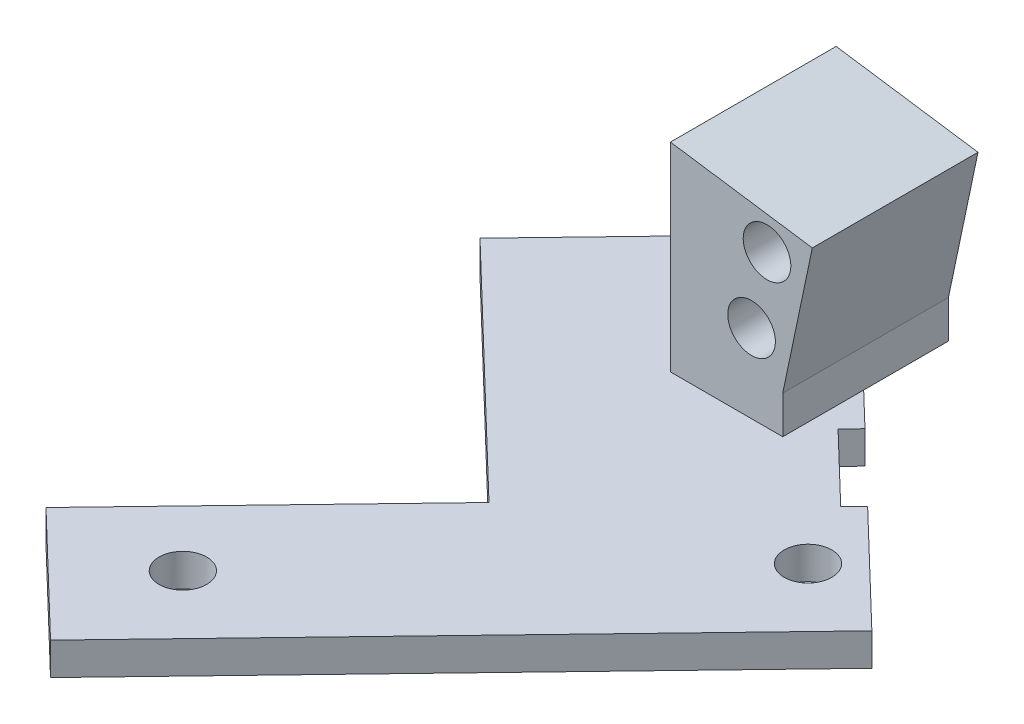
from build123d import *

# Parameters (mm, degrees)
SKETCH1_R            = 3.175
BOSS_EXTRUDE1_DEPTH  = 22.098
SKETCH2_W            = 6.364573253
SKETCH2_H            = 22.098
BOSS_EXTRUDE2_DEPTH  = 8.89
SKETCH12_R           = 3.175
BOSS_EXTRUDE6_DEPTH  = 4.326760245
BOSS_EXTRUDE12_DEPTH = 22.098
CUT_EXTRUDE1_DEPTH   = 35.052
BOSS_EXTRUDE13_DEPTH = 22.098
BOSS_EXTRUDE14_REACH = 685.189
SKETCH22_W           = 11.177544577
SKETCH22_H           = 22.098
CUT_EXTRUDE3_DEPTH   = 39.878
CUT_EXTRUDE4_DEPTH   = 684.154025117


with BuildPart() as part:
    # Sketch1 → Boss-Extrude1 (new body)
    with BuildSketch(Plane.XY):
        Polygon((-629.011320926, 228.514758378), (-646.417262265, 232.174381811), (-650.357758597, 213.432549691), (-632.951817258, 209.772926258), align=None)
        with Locations(Location((-635.053635704, 225, 0), (0, 0, 180))):
            Circle(SKETCH1_R, mode=Mode.SUBTRACT)
        with Locations(Location((-637.11116423, 215.213960129, 0), (0, 0, 180))):
            Circle(SKETCH1_R, mode=Mode.SUBTRACT)
    extrude(amount=BOSS_EXTRUDE1_DEPTH)

    # Sketch2 → Boss-Extrude2 (add)
    with BuildSketch(Plane(origin=(15.442364745, 73.44714554, 0), x_dir=(0.9786039871389689, -0.20575285260650125, 0), z_dir=(-0.20575285260650128, -0.978603987138969, 0))):
        with Locations((-677.174764942, 11.049)):
            Rectangle(SKETCH2_W, SKETCH2_H)
    extrude(amount=BOSS_EXTRUDE2_DEPTH)

    # Sketch12 → Boss-Extrude6 (add)
    with BuildSketch(Plane(origin=(0, 204.732760245, 0), x_dir=(1, 0, 0), z_dir=(0, 1, 0))):
        Polygon((-673.909297528, -79.397690297), (-658.291353122, -94.413693096), (-604.598546014, -38.568519939), (-651.343308245, 6.374621247), (-676.077405689, -19.350983895), (-644.950587864, -49.278122283), align=None)
        with Locations(Location((-657.484410814, -77.571736143, 0), (0, 0, 270))):
            Circle(SKETCH12_R, mode=Mode.SUBTRACT)
        with Locations(Location((-616.617520158, -35.066627769, 0), (0, 0, 270))):
            Circle(SKETCH12_R, mode=Mode.SUBTRACT)
    extrude(amount=-BOSS_EXTRUDE6_DEPTH)

    # Sketch19 → Boss-Extrude12 (add)
    with BuildSketch(Plane.XY.offset(22.098)):
        Polygon((-646.417262265, 232.174381811), (-654.037262265, 232.174381811), (-654.037262265, 204.732760245), (-652.186901457, 204.732760245), align=None)
    extrude(amount=-BOSS_EXTRUDE12_DEPTH)

    # Sketch20 → Cut-Extrude1 (cut)
    with BuildSketch(Plane(origin=(0, 0, 0), x_dir=(-1, 0, 0), z_dir=(0, 0, -1))):
        Polygon((629.011320926, 228.514758378), (654.037262265, 232.174381811), (646.417262265, 232.174381811), align=None)
    extrude(amount=-CUT_EXTRUDE1_DEPTH, mode=Mode.SUBTRACT)

    # Sketch21 → Boss-Extrude13 (add)
    with BuildSketch(Plane(origin=(0, 0, 0), x_dir=(-1, 0, 0), z_dir=(0, 0, -1))):
        Polygon((644.129361835, 212.123020588), (644.129361835, 204.732760245), (645.683174376, 204.732760245), align=None)
    extrude(amount=-BOSS_EXTRUDE13_DEPTH)

    # Sketch22 → Boss-Extrude14 (add, up to next)
    with BuildSketch(Plane(origin=(0, 204.732760245, 0), x_dir=(1, 0, 0), z_dir=(0, 1, 0)), mode=Mode.PRIVATE) as boss_extrude14_sk1:
        with Locations((-638.540589547, -11.049)):
            Rectangle(SKETCH22_W, SKETCH22_H)
    boss_extrude14_tool1 = extrude(boss_extrude14_sk1.sketch, amount=BOSS_EXTRUDE14_REACH, mode=Mode.PRIVATE) - part.part
    add(boss_extrude14_tool1.solids().sort_by_distance((-638.54059, 204.73276, 11.049))[0])

    # Sketch23 → Cut-Extrude3 (cut)
    with BuildSketch(Plane.XY.offset(22.098)):
        Polygon((-647.929135227, 231.281170861), (-647.929135227, 204.732760245), (-654.037262265, 204.732760245), (-654.037262265, 232.174381811), align=None)
    extrude(amount=-CUT_EXTRUDE3_DEPTH, mode=Mode.SUBTRACT)

    # Sketch24 → Cut-Extrude4 (cut, through all)
    with BuildSketch(Plane(origin=(0, 204.732760245, 0), x_dir=(1, 0, 0), z_dir=(0, 1, 0))):
        Polygon((-619.246460285, -24.485160698), (-621.00688019, -26.316149982), (-630.161826609, -17.514050456), (-628.401406704, -15.683061172), align=None)
    extrude(amount=-CUT_EXTRUDE4_DEPTH, mode=Mode.SUBTRACT)


solid = part.part
